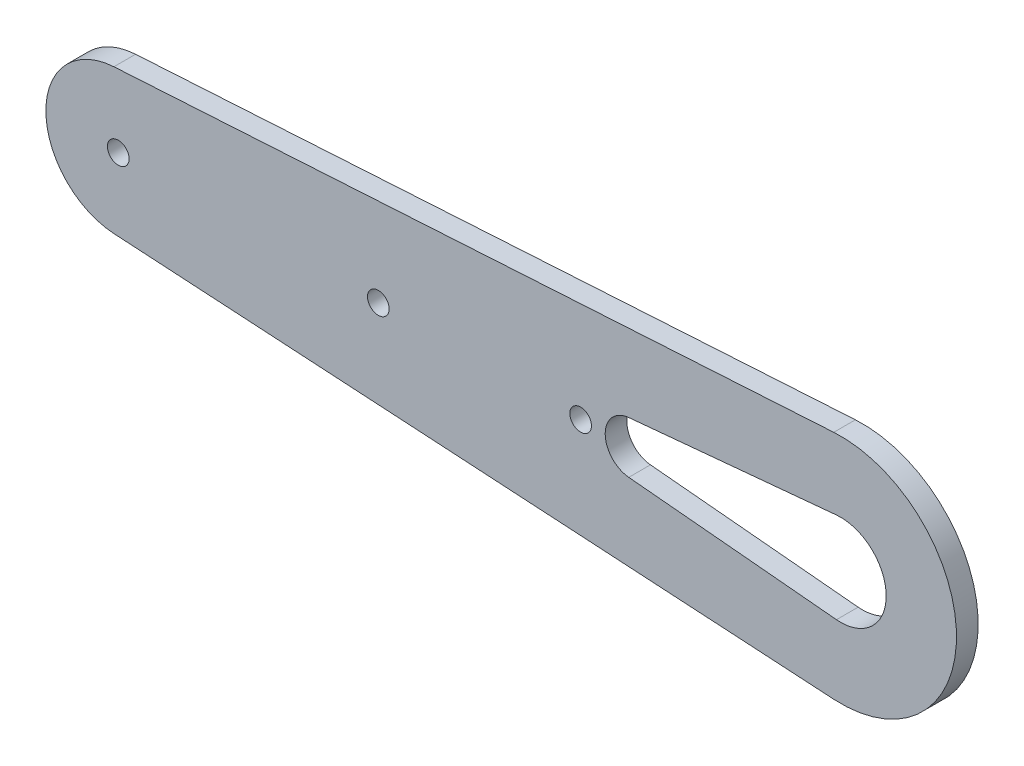
from build123d import *

# Parameters (mm, degrees)
BOSS_EXTRUDE1_DEPTH = 3
SKETCH2_R           = 1.5
CUT_EXTRUDE1_DEPTH  = 3


with BuildPart() as part:
    # Sketch1 → Boss-Extrude1 (new body)
    with BuildSketch(Plane.XY):
        with BuildLine():
            Line((-52.51020312, -2.31327399), (47.128491464, 3.68672601))
            ThreePointArc((47.128491464, 3.68672601), (64.120955569, -12.31327399), (47.128491464, -28.31327399))
            Line((47.128491464, -28.31327399), (-52.51020312, -22.31327399))
            ThreePointArc((-52.51020312, -22.31327399), (-61.926141798, -12.31327399), (-52.51020312, -2.31327399))
        make_face()
    extrude(amount=BOSS_EXTRUDE1_DEPTH)

    # Sketch2 → Cut-Extrude1 (cut)
    with BuildSketch(Plane.XY.offset(3)):
        with Locations((12.091972574, -12.31327399)):
            Circle(SKETCH2_R)
        with Locations((-15.908027426, -12.31327399)):
            Circle(SKETCH2_R)
        with Locations((-51.908027426, -12.31327399)):
            Circle(SKETCH2_R)
        with BuildLine():
            Line((18.75680016, -8.728910804), (47.50542085, -6.040638414))
            ThreePointArc((47.50542085, -6.040638414), (54.391972574, -12.31327399), (47.50542085, -18.585909567))
            Line((47.50542085, -18.585909567), (18.75680016, -15.897637177))
            ThreePointArc((18.75680016, -15.897637177), (15.491972574, -12.31327399), (18.75680016, -8.728910804))
        make_face()
    extrude(amount=-CUT_EXTRUDE1_DEPTH, mode=Mode.SUBTRACT)


solid = part.part
